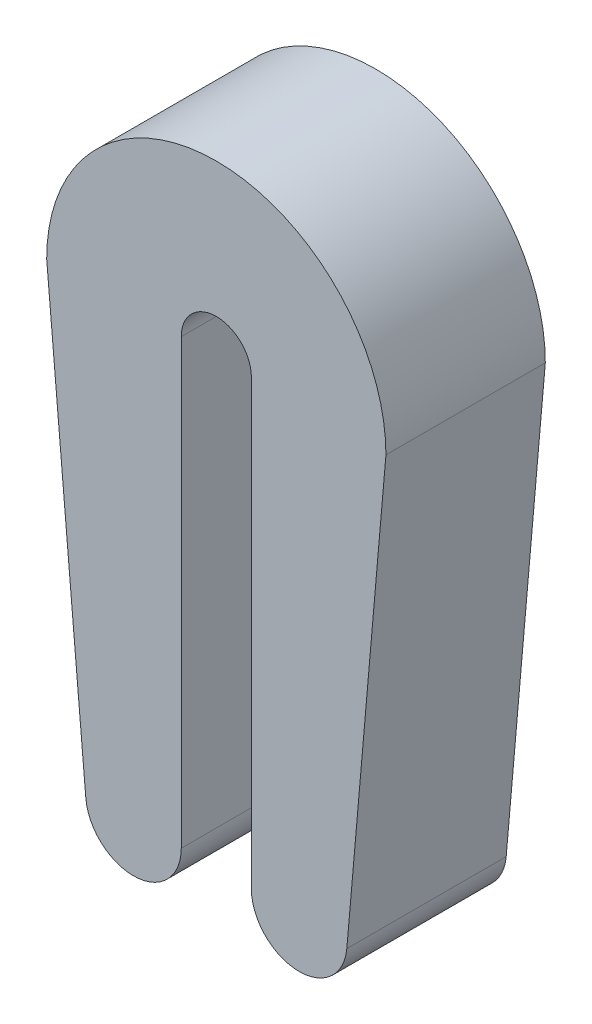
from build123d import *

# Parameters (mm, degrees)
BOSS_EXTRUDE1_DEPTH = 5


with BuildPart() as part:
    # Sketch1 → Boss-Extrude1 (new body)
    with BuildSketch(Plane.XY):
        with BuildLine():
            Line((-1.1, 0), (-1.1, -13.9))
            ThreePointArc((-1.1, -13.9), (-2.534570919, -15.398572332), (-4.094292047, -14.030733614))
            Line((-4.094292047, -14.030733614), (-5.321822179, 0))
            ThreePointArc((-5.321822179, 0), (0, 5.321822179), (5.321822179, 0))
            Line((5.321822179, 0), (4.094292047, -14.030733614))
            ThreePointArc((4.094292047, -14.030733614), (2.534570919, -15.398572332), (1.1, -13.9))
            Line((1.1, -13.9), (1.1, 0))
            ThreePointArc((1.1, 0), (0, 1.1), (-1.1, 0))
        make_face()
    extrude(amount=BOSS_EXTRUDE1_DEPTH)


solid = part.part
